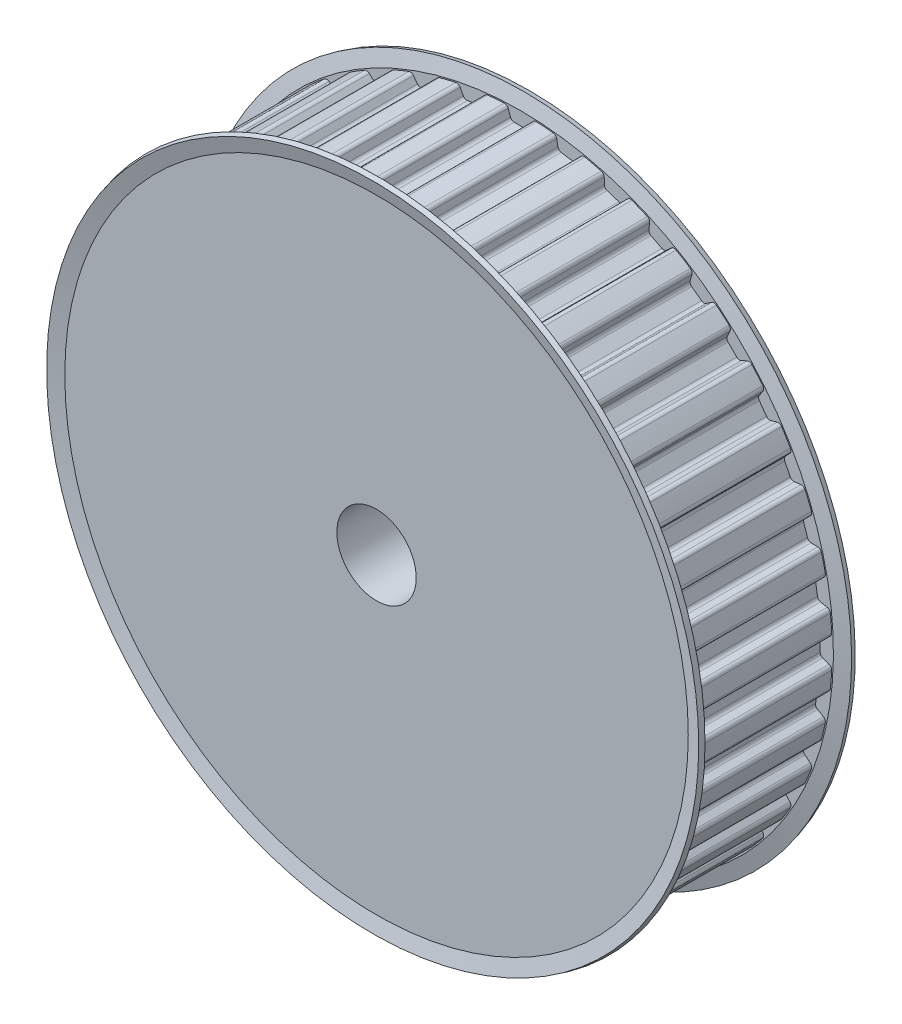
from build123d import *

# Parameters (mm, degrees)
SKETCH5_W           = 15
SKETCH5_H           = 31.425
SKETCH16_W          = 6
SKETCH16_H          = 20
SKETCH17_W          = 21
SKETCH17_H          = 4
CUT_TOOTH_REACH     = 51.153
PATTERN_TOOTH_COUNT = 40


with BuildPart() as part:
    # Sketch5 → body (revolve)
    with BuildSketch(Plane(origin=(0, 0, 0), x_dir=(0, 0, -1), z_dir=(1, 0, 0))):
        with Locations((7.5, 15.7125)):
            Rectangle(SKETCH5_W, SKETCH5_H)
    revolve(axis=Axis((0, 0, 0), (0, 0, -1)))

    # Sketch16 → body-hub (revolve)
    with BuildSketch(Plane(origin=(0, 0, 0), x_dir=(0, 0, -1), z_dir=(1, 0, 0))):
        with Locations((18, 10)):
            Rectangle(SKETCH16_W, SKETCH16_H)
    revolve(axis=Axis((0, 0, -21), (0, 0, 1)))

    # Sketch17 → body-bore (revolve, cut)
    with BuildSketch(Plane(origin=(0, 0, 0), x_dir=(0, 0, -1), z_dir=(1, 0, 0))):
        with Locations((10.5, 2)):
            Rectangle(SKETCH17_W, SKETCH17_H)
    revolve(axis=Axis((0, 0, -21), (0, 0, 1)), mode=Mode.SUBTRACT)

    # Sketch23 → cut-tooth (cut, up to next)
    with BuildSketch(Plane.XY, mode=Mode.PRIVATE) as cut_tooth_sk1:
        with BuildLine():
            Line((1.622438917, 32.583089666), (-1.622438917, 32.583089666))
            Line((-1.622438917, 32.583089666), (-1.622438917, 31.383089666))
            ThreePointArc((-1.622438917, 31.383089666), (-1.380894491, 31.317099285), (-1.225910299, 31.120431188))
            Line((-1.225910299, 31.120431188), (-0.995794033, 30.488191943))
            ThreePointArc((-0.995794033, 30.488191943), (-0.849347559, 30.297339182), (-0.619916985, 30.225))
            Line((-0.619916985, 30.225), (0.619916985, 30.225))
            ThreePointArc((0.619916985, 30.225), (0.849347559, 30.297339182), (0.995794033, 30.488191943))
            Line((0.995794033, 30.488191943), (1.225910299, 31.120431188))
            ThreePointArc((1.225910299, 31.120431188), (1.380894491, 31.317099285), (1.622438917, 31.383089666))
            Line((1.622438917, 31.383089666), (1.622438917, 32.583089666))
        make_face()
    cut_tooth_tool1 = extrude(cut_tooth_sk1.sketch, amount=-CUT_TOOTH_REACH, mode=Mode.PRIVATE) & part.part
    cut_tooth = cut_tooth_tool1.solids().sort_by_distance((0, 31.533212, 0))[0]
    add(cut_tooth, mode=Mode.SUBTRACT)

    # pattern-tooth: cut-tooth ×40 about axis
    pattern_tooth_axis = Axis((0, 0, -15), (0, 0, 1))
    for i in range(1, PATTERN_TOOTH_COUNT):
        add(cut_tooth.rotate(pattern_tooth_axis, i * 360 / PATTERN_TOOTH_COUNT), mode=Mode.SUBTRACT)

    # Sketch25 → body-flange-front (revolve)
    with BuildSketch(Plane(origin=(0, 0, 0), x_dir=(0, 0, -1), z_dir=(1, 0, 0))):
        Polygon((0.5, 28.71375), (0, 28.71375), (0, 31.425), (-0.386121593, 32.866025404), (0.113878407, 33), (0.5, 31.558974596), align=None)
    revolve(axis=Axis((0, 0, 0), (0, 0, -1)))

    # Sketch26 → body-flange-back (revolve)
    with BuildSketch(Plane(origin=(0, 0, 0), x_dir=(0, 0, -1), z_dir=(1, 0, 0))):
        Polygon((14.5, 28.71375), (15, 28.71375), (15, 31.425), (15.386121593, 32.866025404), (14.886121593, 33), (14.5, 31.558974596), align=None)
    revolve(axis=Axis((0, 0, -15), (0, 0, 1)))


solid = part.part
